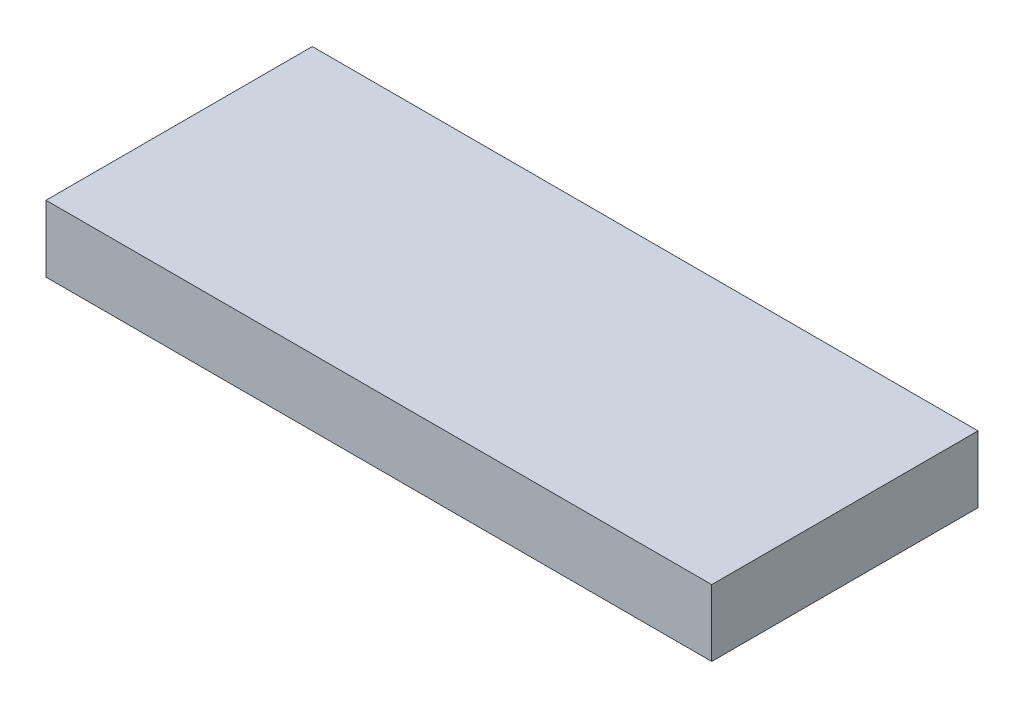
from build123d import *

# Parameters (mm, degrees)
SKETCH1_W           = 304.8
SKETCH1_H           = 101.6
BOSS_EXTRUDE1_DEPTH = 25.4
SKETCH2_W           = 50.8
SKETCH2_H           = 101.6
CUT_EXTRUDE1_DEPTH  = 25.4


with BuildPart() as part:
    # Sketch1 → Boss-Extrude1 (new body)
    with BuildSketch(Plane(origin=(0, 0, 0), x_dir=(1, 0, 0), z_dir=(0, 1, 0))):
        Rectangle(SKETCH1_W, SKETCH1_H)
    extrude(amount=BOSS_EXTRUDE1_DEPTH)

    # Sketch2 → Cut-Extrude1 (cut)
    with BuildSketch(Plane(origin=(0, 25.4, 0), x_dir=(1, 0, 0), z_dir=(0, 1, 0))):
        with Locations((-127, 0)):
            Rectangle(SKETCH2_W, SKETCH2_H)
    extrude(amount=-CUT_EXTRUDE1_DEPTH, mode=Mode.SUBTRACT)


solid = part.part
